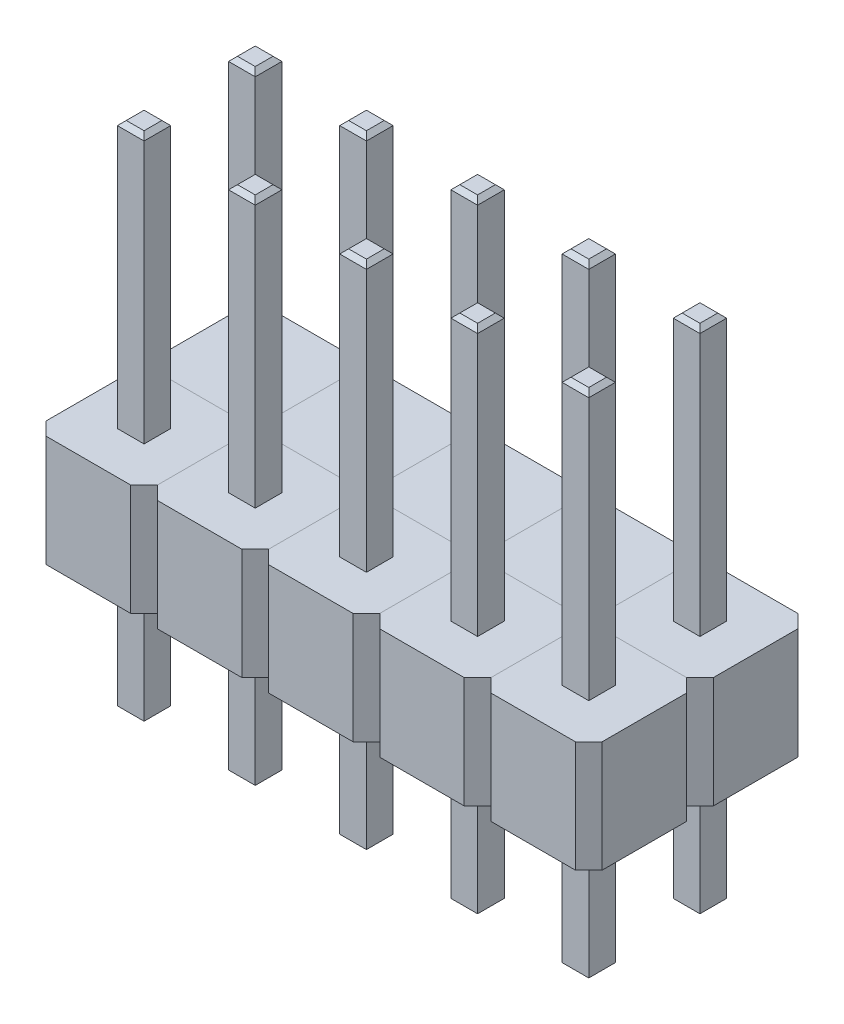
from build123d import *

# Parameters (mm, degrees)
SKETCH1_W                = 71.75
SKETCH1_H                = 58.5
SKETCH1_R                = 1.625
BOSS_EXTRUDE1_DEPTH      = 1.6
BOSS_EXTRUDE5_DEPTH      = 2.5
BOSS_EXTRUDE6_DEPTH      = 6
BOSS_EXTRUDE6_DEPTH_BACK = 5.5
SKETCH8_W                = 0.6
SKETCH8_H                = 0.6
CHAMFER_1_SIZE           = 0.1
LPATTERN1_COUNT          = 5
LPATTERN1_PITCH          = 2.5
LPATTERN1_2_COUNT        = 2
LPATTERN1_2_PITCH        = 2.5


with BuildPart() as part:
    # Sketch1 → Boss-Extrude1 (new body)
    with BuildSketch(Plane(origin=(0, 0, 0), x_dir=(1, 0, 0), z_dir=(0, 1, 0))):
        Rectangle(SKETCH1_W, SKETCH1_H)
        with Locations(Location((-32.85, -26.625, 0), (0, 0, 270))):
            Circle(SKETCH1_R, mode=Mode.SUBTRACT)
        with Locations(Location((32.85, -26.375, 0), (0, 0, 270))):
            Circle(SKETCH1_R, mode=Mode.SUBTRACT)
        with Locations(Location((32.80754717, -3.875, 0), (0, 0, 270))):
            Circle(SKETCH1_R, mode=Mode.SUBTRACT)
        with Locations(Location((32.75, 26.625, 0), (0, 0, 270))):
            Circle(SKETCH1_R, mode=Mode.SUBTRACT)
        with Locations(Location((-16.4, 26.625, 0), (0, 0, 270))):
            Circle(SKETCH1_R, mode=Mode.SUBTRACT)
    extrude(amount=BOSS_EXTRUDE1_DEPTH)


with BuildPart() as body_2:
    # Sketch7 → Boss-Extrude5 (new body)
    with BuildSketch(Plane(origin=(0, 1.6, 0), x_dir=(1, 0, 0), z_dir=(0, 1, 0))):
        Polygon((-28.275, -25.85), (-27.975, -25.55), (-26.075, -25.55), (-25.775, -25.85), (-25.775, -27.75), (-26.075, -28.05), (-27.975, -28.05), (-28.275, -27.75), align=None)
    extrude(amount=BOSS_EXTRUDE5_DEPTH)


with BuildPart() as body_3:
    # Sketch8 → Boss-Extrude6 (new, two sides: drawn at the far end of the back side and taken through both)
    with BuildSketch(Plane(origin=(0, 4.1, 0), x_dir=(1, 0, 0), z_dir=(0, 1, 0)).offset(-BOSS_EXTRUDE6_DEPTH_BACK)):
        with Locations((-27.025, -26.8)):
            Rectangle(SKETCH8_W, SKETCH8_H)
    extrude(amount=BOSS_EXTRUDE6_DEPTH + BOSS_EXTRUDE6_DEPTH_BACK)

    # Фаска1
    chamfer_1_edges = [body_3.edges().sort_by_distance(p)[0] for p in [
        (-26.725, 10.1, 26.8),
        (-27.325, -1.4, 26.8),
        (-27.025, 10.1, 26.5),
        (-27.325, 10.1, 26.8),
        (-27.025, 10.1, 27.1),
        (-27.025, -1.4, 27.1),
        (-26.725, -1.4, 26.8),
        (-27.025, -1.4, 26.5),
    ]]
    chamfer(chamfer_1_edges, length=CHAMFER_1_SIZE)


with BuildPart() as lpattern1_1:
    # LPattern1: pattern copy
    add(body_2.part.moved(Location(Vector(1, 0, 0) * (1 * LPATTERN1_PITCH))))


with BuildPart() as lpattern1_2:
    # LPattern1: pattern copy
    add(body_2.part.moved(Location(Vector(1, 0, 0) * (2 * LPATTERN1_PITCH))))


with BuildPart() as lpattern1_3:
    # LPattern1: pattern copy
    add(body_2.part.moved(Location(Vector(1, 0, 0) * (3 * LPATTERN1_PITCH))))


with BuildPart() as lpattern1_4:
    # LPattern1: pattern copy
    add(body_2.part.moved(Location(Vector(1, 0, 0) * (4 * LPATTERN1_PITCH))))


with BuildPart() as lpattern1_5:
    # LPattern1: pattern copy
    add(body_3.part.moved(Location(Vector(1, 0, 0) * (1 * LPATTERN1_PITCH))))


with BuildPart() as lpattern1_6:
    # LPattern1: pattern copy
    add(body_3.part.moved(Location(Vector(1, 0, 0) * (2 * LPATTERN1_PITCH))))


with BuildPart() as lpattern1_7:
    # LPattern1: pattern copy
    add(body_3.part.moved(Location(Vector(1, 0, 0) * (3 * LPATTERN1_PITCH))))


with BuildPart() as lpattern1_8:
    # LPattern1: pattern copy
    add(body_3.part.moved(Location(Vector(1, 0, 0) * (4 * LPATTERN1_PITCH))))


with BuildPart() as lpattern1_2_1:
    # LPattern1 2: pattern copy
    add(body_2.part.moved(Location(Vector(0, 0, -1) * (1 * LPATTERN1_2_PITCH))))


with BuildPart() as lpattern1_2_2:
    # LPattern1 2: pattern copy
    add(body_3.part.moved(Location(Vector(0, 0, -1) * (1 * LPATTERN1_2_PITCH))))


with BuildPart() as lpattern1_2_3:
    # LPattern1 2: pattern copy
    add(lpattern1_1.part.moved(Location(Vector(0, 0, -1) * (1 * LPATTERN1_2_PITCH))))


with BuildPart() as lpattern1_2_4:
    # LPattern1 2: pattern copy
    add(lpattern1_2.part.moved(Location(Vector(0, 0, -1) * (1 * LPATTERN1_2_PITCH))))


with BuildPart() as lpattern1_2_5:
    # LPattern1 2: pattern copy
    add(lpattern1_3.part.moved(Location(Vector(0, 0, -1) * (1 * LPATTERN1_2_PITCH))))


with BuildPart() as lpattern1_2_6:
    # LPattern1 2: pattern copy
    add(lpattern1_4.part.moved(Location(Vector(0, 0, -1) * (1 * LPATTERN1_2_PITCH))))


with BuildPart() as lpattern1_2_7:
    # LPattern1 2: pattern copy
    add(lpattern1_5.part.moved(Location(Vector(0, 0, -1) * (1 * LPATTERN1_2_PITCH))))


with BuildPart() as lpattern1_2_8:
    # LPattern1 2: pattern copy
    add(lpattern1_6.part.moved(Location(Vector(0, 0, -1) * (1 * LPATTERN1_2_PITCH))))


with BuildPart() as lpattern1_2_9:
    # LPattern1 2: pattern copy
    add(lpattern1_7.part.moved(Location(Vector(0, 0, -1) * (1 * LPATTERN1_2_PITCH))))


with BuildPart() as lpattern1_2_10:
    # LPattern1 2: pattern copy
    add(lpattern1_8.part.moved(Location(Vector(0, 0, -1) * (1 * LPATTERN1_2_PITCH))))


solid = Compound([body_2.part, body_3.part, lpattern1_1.part, lpattern1_2.part, lpattern1_3.part, lpattern1_4.part, lpattern1_5.part, lpattern1_6.part, lpattern1_7.part, lpattern1_8.part, lpattern1_2_1.part, lpattern1_2_2.part, lpattern1_2_3.part, lpattern1_2_4.part, lpattern1_2_5.part, lpattern1_2_6.part, lpattern1_2_7.part, lpattern1_2_8.part, lpattern1_2_9.part, lpattern1_2_10.part])
